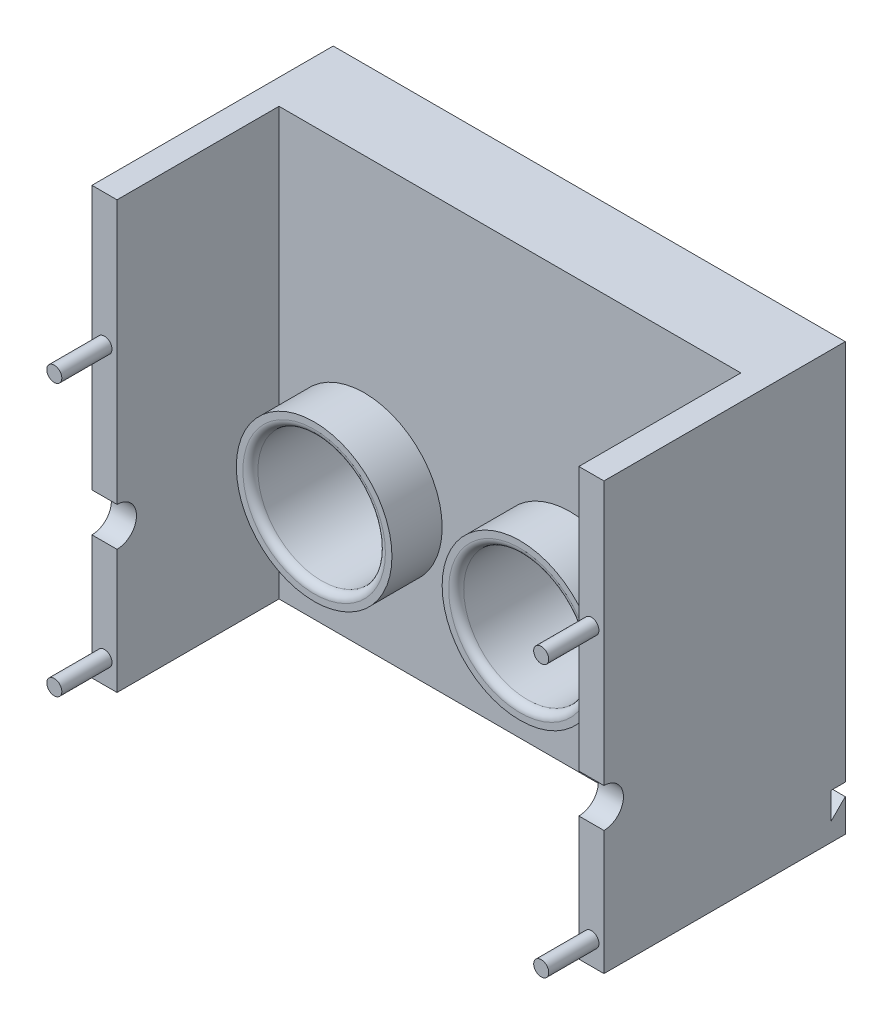
from build123d import *

# Parameters (mm, degrees)
SKETCH2_W           = 102
SKETCH2_H           = 96.13
SKETCH2_W_2         = 92
SKETCH2_H_2         = 64.53
BOSS_EXTRUDE1_DEPTH = 85
SKETCH8_R           = 10.25
CUT_EXTRUDE7_DEPTH  = 20
SKETCH9_R           = 12.7
CUT_EXTRUDE8_DEPTH  = 20
SKETCH10_R          = 3.875
CUT_EXTRUDE9_DEPTH  = 142.206388754
SKETCH11_W          = 48.065
SKETCH11_H          = 85
CUT_EXTRUDE10_DEPTH = 142.206388754
SKETCH14_R          = 1.5
BOSS_EXTRUDE2_DEPTH = 10
SKETCH15_R          = 15.5
SKETCH15_R_2        = 12.7
BOSS_EXTRUDE3_DEPTH = 10
FILLET1_R           = 1.5
CUT_EXTRUDE11_DEPTH = 142.206388754


with BuildPart() as part:
    # Sketch2 → Boss-Extrude1 (new body)
    with BuildSketch(Plane(origin=(0, 0, 0), x_dir=(1, 0, 0), z_dir=(0, 1, 0))):
        Rectangle(SKETCH2_W, SKETCH2_H)
        Rectangle(SKETCH2_W_2, SKETCH2_H_2, mode=Mode.SUBTRACT)
    extrude(amount=BOSS_EXTRUDE1_DEPTH)

    # Sketch8 → Cut-Extrude7 (cut)
    with BuildSketch(Plane.XY.offset(48.065)):
        with Locations((-31, 31.7)):
            Circle(SKETCH8_R)
        with Locations((29, 31.7)):
            Circle(SKETCH8_R)
    extrude(amount=-CUT_EXTRUDE7_DEPTH, mode=Mode.SUBTRACT)

    # Sketch9 → Cut-Extrude8 (cut)
    with BuildSketch(Plane(origin=(0, 0, -48.065), x_dir=(-1, 0, 0), z_dir=(0, 0, -1))):
        with Locations((-12, 28.575)):
            Circle(SKETCH9_R)
        with Locations((29, 28.575)):
            Circle(SKETCH9_R)
    extrude(amount=-CUT_EXTRUDE8_DEPTH, mode=Mode.SUBTRACT)

    # Sketch10 → Cut-Extrude9 (cut, through all)
    with BuildSketch(Plane.ZY.offset(51)):
        with Locations((0, 28.575)):
            Circle(SKETCH10_R)
    extrude(amount=-CUT_EXTRUDE9_DEPTH, mode=Mode.SUBTRACT)

    # Sketch11 → Cut-Extrude10 (cut, through all)
    with BuildSketch(Plane.ZY.offset(51)):
        with Locations((24.0325, 42.5)):
            Rectangle(SKETCH11_W, SKETCH11_H)
    extrude(amount=-CUT_EXTRUDE10_DEPTH, mode=Mode.SUBTRACT)

    # Sketch14 → Boss-Extrude2 (add)
    with BuildSketch(Plane.XY):
        with Locations(Location((-48.5, 58.725, 0), (0, 0, 180))):
            Circle(SKETCH14_R)
        with Locations(Location((-48.5, 4.675, 0), (0, 0, 180))):
            Circle(SKETCH14_R)
        with Locations(Location((48.5, 4.675, 0), (0, 0, 180))):
            Circle(SKETCH14_R)
        with Locations(Location((48.5, 58.725, 0), (0, 0, 180))):
            Circle(SKETCH14_R)
    extrude(amount=BOSS_EXTRUDE2_DEPTH)

    # Sketch15 → Boss-Extrude3 (add)
    # profile 1 of 2: a face of its own
    with BuildSketch(Plane.XY.offset(-32.265)):
        with Locations((12, 28.575)):
            Circle(SKETCH15_R)
        with Locations(Location((12, 28.575, 0), (0, 0, 180))):
            Circle(SKETCH15_R_2, mode=Mode.SUBTRACT)
    # profile 2 of 2: a face of its own
    with BuildSketch(Plane.XY.offset(-32.265)):
        with Locations((-29, 28.575)):
            Circle(SKETCH15_R)
        with Locations(Location((-29, 28.575, 0), (0, 0, 180))):
            Circle(SKETCH15_R_2, mode=Mode.SUBTRACT)
    extrude(amount=BOSS_EXTRUDE3_DEPTH)

    # Fillet1
    fillet1_edges = [part.edges().sort_by_distance(p)[0] for p in [
        (24.7, 28.575, -22.265),
        (-16.3, 28.575, -22.265),
    ]]
    fillet(fillet1_edges, radius=FILLET1_R)

    # Sketch16 → Cut-Extrude11 (cut, through all)
    with BuildSketch(Plane.ZY.offset(51)):
        Polygon((-48.065, 6.5), (-45.236572875, 3.671572875), (-45.236572875, 9), (-48.065, 9), align=None)
    extrude(amount=-CUT_EXTRUDE11_DEPTH, mode=Mode.SUBTRACT)


solid = part.part
